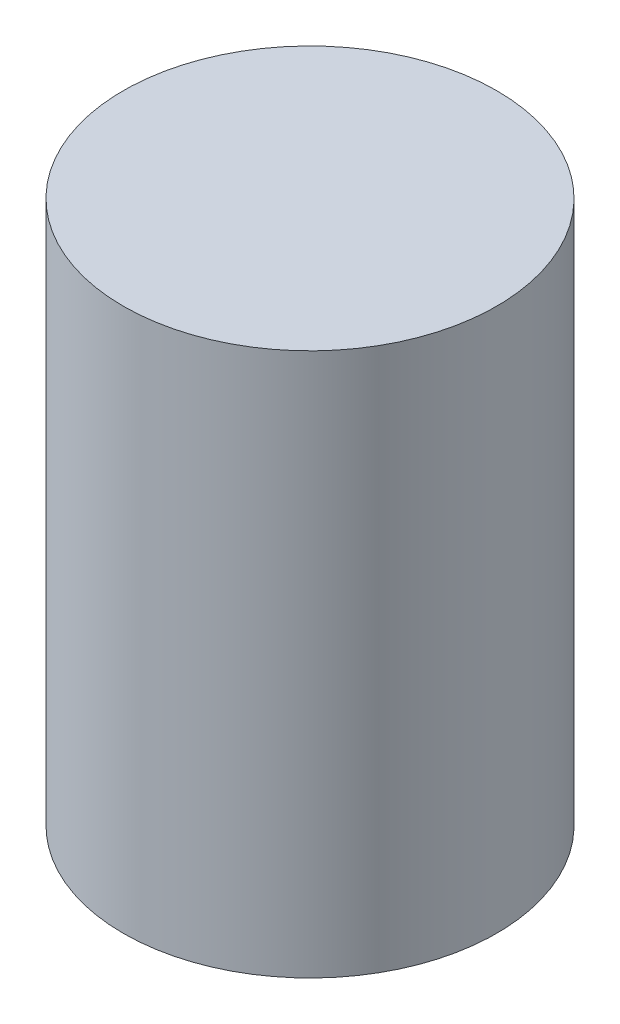
from build123d import *

# Parameters (mm, degrees)
SKETCH1_R           = 13.75
BOSS_EXTRUDE1_DEPTH = 40


with BuildPart() as part:
    # Sketch1 → Boss-Extrude1 (new body)
    with BuildSketch(Plane(origin=(0, 0, 0), x_dir=(1, 0, 0), z_dir=(0, 1, 0))):
        with Locations(Location((0, 0, 0), (0, 0, 270))):
            Circle(SKETCH1_R)
    extrude(amount=BOSS_EXTRUDE1_DEPTH)


solid = part.part
